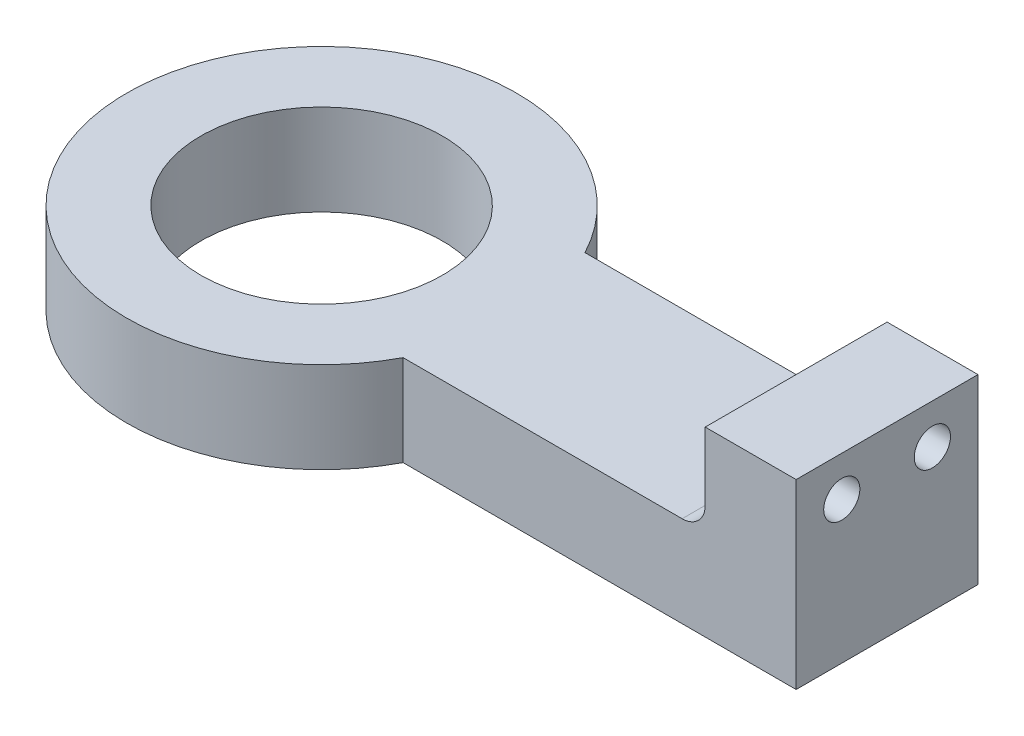
from build123d import *

# Parameters (mm, degrees)
SKETCH1_R           = 26.56205
BOSS_EXTRUDE2_DEPTH = 20
SKETCH2_W           = 20
SKETCH2_H           = 20
BOSS_EXTRUDE3_DEPTH = 40
SKETCH3_R           = 3.9773733
SKETCH3_R_2         = 3.985133
CUT_EXTRUDE1_DEPTH  = 159.491729693
FILLET1_R           = 5.08


with BuildPart() as part:
    # Sketch1 → Boss-Extrude2 (new body)
    # profile 1 of 3: a face of its own
    with BuildSketch(Plane(origin=(0, 0, 0), x_dir=(1, 0, 0), z_dir=(0, 1, 0))):
        with BuildLine():
            Line((37.922816996, -20), (37.922816996, 20))
            ThreePointArc((37.922816996, 20), (-42.873535531, 0), (37.922816996, -20))
        make_face()
        with Locations(Location((0, 0, 0), (0, 0, 270))):
            Circle(SKETCH1_R, mode=Mode.SUBTRACT)
    # profile 2 of 3: a face of its own
    with BuildSketch(Plane(origin=(0, 0, 0), x_dir=(1, 0, 0), z_dir=(0, 1, 0))):
        with BuildLine():
            Line((124.372816996, 20), (37.922816996, 20))
            ThreePointArc((37.922816996, 20), (41.617456018, 10.301815544), (42.873535531, 0))
            ThreePointArc((42.873535531, 0), (41.617456018, -10.301815544), (37.922816996, -20))
            Line((37.922816996, -20), (124.372816996, -20))
            Line((124.372816996, -20), (124.372816996, 20))
        make_face()
    # profile 3 of 3: a face of its own
    with BuildSketch(Plane(origin=(0, 0, 0), x_dir=(1, 0, 0), z_dir=(0, 1, 0))):
        with BuildLine():
            ThreePointArc((42.873535531, 0), (41.617456018, 10.301815544), (37.922816996, 20))
            Line((37.922816996, 20), (37.922816996, -20))
            ThreePointArc((37.922816996, -20), (41.617456018, -10.301815544), (42.873535531, 0))
        make_face()
    extrude(amount=BOSS_EXTRUDE2_DEPTH)

    # Sketch2 → Boss-Extrude3 (add)
    with BuildSketch(Plane(origin=(0, 0, -20), x_dir=(-1, 0, 0), z_dir=(0, 0, -1))):
        with Locations((-114.372816996, 30)):
            Rectangle(SKETCH2_W, SKETCH2_H)
    extrude(amount=-BOSS_EXTRUDE3_DEPTH)

    # Sketch3 → Cut-Extrude1 (cut, through all)
    with BuildSketch(Plane.ZY.offset(-104.372816996)):
        with Locations((9.96192, 31.22176)):
            Circle(SKETCH3_R)
        with Locations((-9.96192, 31.22176)):
            Circle(SKETCH3_R_2)
    extrude(amount=-CUT_EXTRUDE1_DEPTH, mode=Mode.SUBTRACT)

    # Fillet1
    fillet1_edges = [part.edges().sort_by_distance(p)[0] for p in [
        (104.372816996, 20, 0),
    ]]
    fillet(fillet1_edges, radius=FILLET1_R)


solid = part.part
